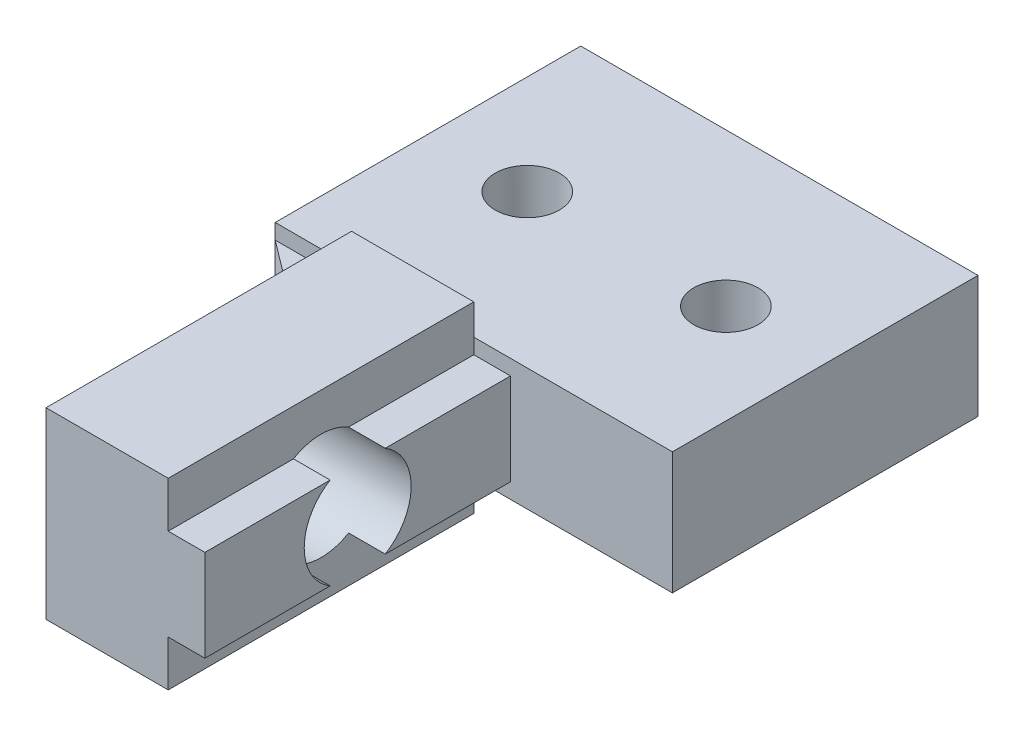
from build123d import *

# Parameters (mm, degrees)
SKETCH_2_W          = 13
SKETCH_2_H          = 10
SKETCH_2_R          = 1.05
EXTRUDE_1_DEPTH     = 6
EXTRUDE_2_DEPTH     = 10
SKETCH_4_W          = 13
SKETCH_4_H          = 10
CUT_EXTRUDE_1_DEPTH = 1
SKETCH_5_W          = 13
SKETCH_5_H          = 10
CUT_EXTRUDE_2_DEPTH = 1
SKETCH_6_R          = 1.75
CUT_EXTRUDE_3_DEPTH = 20.267848868
RIB_1_REACH         = 18.956
SKETCH_7_WALL_W     = 39.23500661
SKETCH_7_WALL_H     = 3


with BuildPart() as part:
    # 草图2 → 凸台-拉伸1 (new body)
    with BuildSketch(Plane(origin=(0, 0, 0), x_dir=(1, 0, 0), z_dir=(0, 1, 0))):
        Rectangle(SKETCH_2_W, SKETCH_2_H)
        with Locations(Location((-3.25, 0, 0), (0, 0, 270))):
            Circle(SKETCH_2_R, mode=Mode.SUBTRACT)
        with Locations(Location((3.25, 0, 0), (0, 0, 270))):
            Circle(SKETCH_2_R, mode=Mode.SUBTRACT)
    extrude(amount=EXTRUDE_1_DEPTH)

    # 草图3 → 凸台-拉伸2 (add)
    with BuildSketch(Plane.XY.offset(5)):
        Polygon((0, 6), (0, 4.5), (1.2, 4.5), (1.2, 1.5), (0, 1.5), (0, 0), (-4, 0), (-4, 6), align=None)
    extrude(amount=EXTRUDE_2_DEPTH)

    # 草图4 → 切除-拉伸1 (cut)
    with BuildSketch(Plane(origin=(0, 6, 0), x_dir=(1, 0, 0), z_dir=(0, 1, 0))):
        Rectangle(SKETCH_4_W, SKETCH_4_H)
    extrude(amount=-CUT_EXTRUDE_1_DEPTH, mode=Mode.SUBTRACT)

    # 草图5 → 切除-拉伸2 (cut)
    with BuildSketch(Plane.XZ):
        Rectangle(SKETCH_5_W, SKETCH_5_H)
    extrude(amount=-CUT_EXTRUDE_2_DEPTH, mode=Mode.SUBTRACT)

    # 草图6 → 切除-拉伸3 (cut, through all)
    with BuildSketch(Plane.ZY.offset(4)):
        with Locations((10, 3)):
            Circle(SKETCH_6_R)
    extrude(amount=-CUT_EXTRUDE_3_DEPTH, mode=Mode.SUBTRACT)

    # 草图7 wall → 筋1 (add, up to next)
    with BuildSketch(Plane(origin=(-5.172907339, 1.5, 6), x_dir=(0.798645937054, 0, 0.601801185798), z_dir=(-0.601801185798, 0, 0.798645937054)), mode=Mode.PRIVATE) as rib_1_sk1:
        with Locations((0, 1.5)):
            Rectangle(SKETCH_7_WALL_W, SKETCH_7_WALL_H)
    rib_1_tool1 = extrude(rib_1_sk1.sketch, amount=-RIB_1_REACH, mode=Mode.PRIVATE) - part.part
    add(rib_1_tool1.solids().sort_by_distance((-5.172907339, 1.5, 6))[0])


solid = part.part
